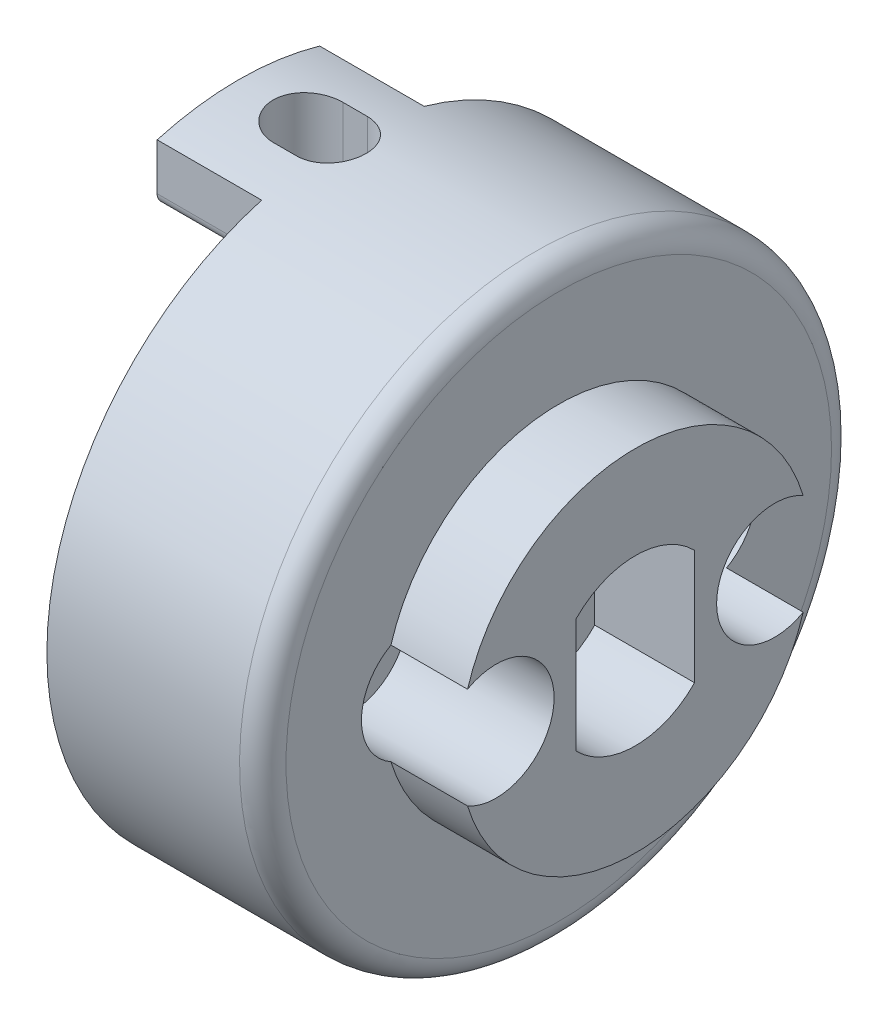
from build123d import *
from build123d.topology import SkipClean

# Parameters (mm, degrees)
SKETCH_1_R               = 12.75
EXTRUDE_1_DEPTH          = 7
EXTRUDE_START            = -2.3
SKETCH_1_3_R             = 12.75
SKETCH_1_3_R_2           = 9.75
EXTRUDE_2_DEPTH          = 2.3
EXTRUDE_3_DEPTH          = 3.3
FILLET_1_R               = 1
EXTRUDE_4_DEPTH          = 3.3
CUT_EXTRUDE_1_REACH      = 22.288
SKETCH_6_R               = 1.3500000000000005
SKETCH_6_R_2             = 1.5499999999999994
CUT_EXTRUDE_START        = -1
CUT_EXTRUDE_2_DEPTH      = 1
EXTRUDE_START_2          = 4.5
EXTRUDE_5_DEPTH          = 4.5
CUT_EXTRUDE_3_DEPTH      = 3
CUT_EXTRUDE_3_DEPTH_BACK = 25
SKETCH_17_R              = 2.5
SKETCH_17_R_2            = 2.5000000000000004
CUT_EXTRUDE_4_DEPTH      = 6.3
SKETCH_18_R              = 2.1
CUT_EXTRUDE_5_DEPTH      = 19.000000000000004


with BuildPart() as part:
    # 草图1 → 凸台-拉伸1 (new body)
    with BuildSketch(Plane(origin=(0, 0, 0), x_dir=(0, 0, -1), z_dir=(1, 0, 0))):
        Circle(SKETCH_1_R)
    extrude(amount=EXTRUDE_1_DEPTH)

    # 草图1<3> → 凸台-拉伸2 (add)
    with BuildSketch(Plane(origin=(0, 0, 0), x_dir=(0, 0, -1), z_dir=(1, 0, 0)).offset(EXTRUDE_START)):
        Circle(SKETCH_1_3_R)
        Circle(SKETCH_1_3_R_2, mode=Mode.SUBTRACT)
    extrude(amount=EXTRUDE_2_DEPTH)

    # 草图4 → 凸台-拉伸3 (add)
    with BuildSketch(Plane(origin=(7, 0, 0), x_dir=(0, 0, -1), z_dir=(1, 0, 0))):
        with BuildLine():
            Line((7.293731545630563, -1.9503794862215074), (5.5903528728314456, -1.4948876985254207))
            ThreePointArc((5.590352872831452, -1.4948876985253963), (4.450095710648993, -0.01722480337626947), (5.557231396787749, 1.4854144081735148))
            ThreePointArc((5.557231396787749, 1.4854144081735148), (5.599745988830406, 1.4974300406171406), (5.642585759719926, 1.508229114174971))
            Line((5.642585759719926, 1.5082291141749726), (7.293933423650666, 1.949624376989515))
            ThreePointArc((7.293933423650662, 1.949624376989514), (4.6e-16, 7.550000000000002), (-7.293933423650662, 1.949624376989515))
            Line((-7.293933423650666, 1.949624376989515), (-5.642585759719924, 1.5082291141749722))
            ThreePointArc((-5.642585759719924, 1.5082291141749706), (-5.599745988830406, 1.4974300406171406), (-5.557231396787749, 1.4854144081735148))
            ThreePointArc((-5.557231396787749, 1.4854144081735148), (-4.757262832498563, 0.9263392102844973), (-4.449999999999999, 0))
            ThreePointArc((-4.449999999999999, -3.8e-16), (-4.767633770522892, -0.9400922701758461), (-5.590352872831452, -1.4948876985253963))
            Line((-5.5903528728314456, -1.4948876985254207), (-7.293731545630563, -1.9503794862215074))
            ThreePointArc((-7.2937315456305605, -1.950379486221506), (-1.39e-15, -7.550000000000002), (7.2937315456305605, -1.9503794862215056))
        make_face()
        with BuildLine():
            ThreePointArc((-0.9205316546017519, -3.4285742624123157), (-1.7750000000000141, -3.074390183434749), (-2.5089665827097076, -2.5114909290789753))
            ThreePointArc((-2.5089665827097076, -2.5114909290789753), (-2.5295691102475106, -2.490738869589025), (-2.55, -2.4698178070456938))
            Line((-2.55, -2.4698178070456938), (-2.55, 0))
            Line((-2.55, 0), (-2.55, 2.4698178070456938))
            ThreePointArc((-2.55, 2.469817807045694), (2.2e-16, 3.5499999999999994), (2.55, 2.4698178070456938))
            Line((2.55, 2.4698178070456938), (2.55, -1.2e-16))
            Line((2.55, -1.2e-16), (2.55, -2.4698178070456938))
            ThreePointArc((2.549999999999999, -2.4698178070456946), (0.9453016753082151, -3.4218276903811913), (-0.9205316546017519, -3.4285742624123157))
        make_face(mode=Mode.SUBTRACT)
    extrude(amount=EXTRUDE_3_DEPTH)

    # 圆角1
    fillet_1_edges = [part.edges().sort_by_distance(p)[0] for p in [
        (7, 1.56e-15, 12.75),
    ]]
    fillet(fillet_1_edges, radius=FILLET_1_R)

    # 草图5 → 凸台-拉伸4 (add)
    with BuildSketch(Plane(origin=(7, 0, 0), x_dir=(0, 0, -1), z_dir=(1, 0, 0))):
        with BuildLine():
            ThreePointArc((5.65345654698472, -1.3047634403110198), (4.6499999999999995, 1.7e-16), (5.65345654698472, 1.3047634403110198))
            Line((5.65345654698472, 1.3047634403110195), (7.3500000000000005, 1.7553631492193538))
            Line((7.3500000000000005, 1.7553631492193538), (7.293933423650666, 1.9496243769895145))
            Line((7.293933423650666, 1.9496243769895145), (5.642585759719882, 1.5082291141749606))
            ThreePointArc((5.642585759719882, 1.5082291141749606), (4.4500975021885605, 0.01738526036219645), (5.60884432582712, -1.499832403491257))
            Line((5.60884432582712, -1.499832403491257), (7.293731545630563, -1.950379486221502))
            Line((7.293731545630563, -1.950379486221502), (7.3500000000000005, -1.7595376594411802))
            Line((7.3500000000000005, -1.7595376594411802), (5.65345654698472, -1.3047634403110195))
        make_face()
    extrude(amount=EXTRUDE_4_DEPTH)

    # 草图6 → 切除-拉伸1 (cut, up to next)
    with BuildSketch(Plane(origin=(7, 0, 0), x_dir=(0, 0, -1), z_dir=(1, 0, 0)), mode=Mode.PRIVATE) as cut_extrude_1_sk1:
        with Locations(Location((6, 0, 0), (0, 0, 255.125726416))):
            Circle(SKETCH_6_R)
    cut_extrude_1_tool1 = extrude(cut_extrude_1_sk1.sketch, amount=-CUT_EXTRUDE_1_REACH, mode=Mode.PRIVATE) & part.part
    # 草图6 → 切除-拉伸1 (cut, up to next)
    with BuildSketch(Plane(origin=(7, 0, 0), x_dir=(0, 0, -1), z_dir=(1, 0, 0)), mode=Mode.PRIVATE) as cut_extrude_1_sk2:
        with Locations(Location((-6, -7.3e-16, 0), (0, 0, 76.668199875))):
            Circle(SKETCH_6_R_2)
    cut_extrude_1_tool2 = extrude(cut_extrude_1_sk2.sketch, amount=-CUT_EXTRUDE_1_REACH, mode=Mode.PRIVATE) & part.part
    add(cut_extrude_1_tool1.solids().sort_by_distance((7, 0, -6))[0], mode=Mode.SUBTRACT)
    add(cut_extrude_1_tool2.solids().sort_by_distance((7, 0, 6))[0], mode=Mode.SUBTRACT)

    # 草图7 → 切除-拉伸2 (cut)
    with BuildSketch(Plane(origin=(7, 0, 0), x_dir=(0, 0, -1), z_dir=(1, 0, 0)).offset(CUT_EXTRUDE_START)):
        with BuildLine():
            Line((2.55, -2.4698178070456938), (2.55, 2.4698178070456938))
            ThreePointArc((2.55, 2.4698178070456938), (2.2e-16, 3.55), (-2.55, 2.4698178070456938))
            Line((-2.55, 2.4698178070456938), (-2.55, -2.4698178070456938))
            ThreePointArc((-2.55, -2.4698178070456938), (2.2e-16, -3.55), (2.55, -2.4698178070456938))
        make_face()
    extrude(amount=CUT_EXTRUDE_2_DEPTH, mode=Mode.SUBTRACT)

    # 草图9 → 凸台-拉伸5 (add)
    with SkipClean():  # the faces are left unmerged after this step: merging them gives an invalid solid
        with BuildSketch(Plane.ZY.offset(2.3).offset(EXTRUDE_START_2)):
            with BuildLine():
                ThreePointArc((-3.4999999999999996, 10.25), (-3.3535533905932735, 9.896446609406727), (-3, 9.75))
                Line((-3, 9.75), (3, 9.75))
                ThreePointArc((3, 9.75), (3.3535533905932735, 9.896446609406727), (3.5000000000000004, 10.25))
                Line((3.5, 10.25), (3.5, 12.260199835239227))
                ThreePointArc((3.5000000000000004, 12.260199835239227), (1e-15, 12.75), (-3.5, 12.260199835239227))
                Line((-3.5, 12.260199835239227), (-3.5, 10.25))
            make_face()
            with BuildLine():
                Line((-3.5, -10.25), (-3.5, -12.260199835239227))
                ThreePointArc((-3.5, -12.260199835239227), (1e-15, -12.75), (3.5000000000000004, -12.260199835239227))
                Line((3.5, -12.260199835239227), (3.5, -10.25))
                ThreePointArc((3.5000000000000004, -10.25), (3.3535533905932735, -9.896446609406727), (3, -9.75))
                Line((3, -9.75), (-3, -9.75))
                ThreePointArc((-3, -9.75), (-3.3535533905932735, -9.896446609406727), (-3.4999999999999996, -10.25))
            make_face()
        extrude(amount=-EXTRUDE_5_DEPTH)

    # 草图16 → 切除-拉伸3 (cut, two sides: drawn at the far end of the back side and taken through both)
    with BuildSketch(Plane(origin=(0, 9.75, 0), x_dir=(1, 0, 0), z_dir=(0, 1, 0)).offset(-CUT_EXTRUDE_3_DEPTH_BACK)):
        with BuildLine():
            Line((-3.797155055625174, 1.499995743144704), (-3.8000000000000003, 1.499998441052766))
            ThreePointArc((-3.8000000000000003, 1.499998441052766), (-5.299998441052766, 3.3e-16), (-3.8000000000000007, -1.4999984410527665))
            Line((-3.8000000000000003, -1.4999984410527663), (-3.7988775259417356, -1.4999980210696007))
            Line((-3.7988775259417356, -1.4999980210696007), (-2.8462661595831507, -1.4996415934672602))
            ThreePointArc((-2.8462661595831507, -1.4996415934672602), (-1.300658265078132, -0.05513463794275678), (-2.735998812247351, 1.4989894310320704))
            Line((-2.735998812247351, 1.49898943103207), (-2.8611580419850906, 1.4991081216110296))
            Line((-2.8611580419850906, 1.4991081216110296), (-3.797155055625174, 1.499995743144704))
        make_face()
    extrude(amount=CUT_EXTRUDE_3_DEPTH + CUT_EXTRUDE_3_DEPTH_BACK, mode=Mode.SUBTRACT)

    # 草图17 → 切除-拉伸4 (cut)
    with SkipClean():  # the faces are left unmerged after this step: merging them gives an invalid solid
        with BuildSketch(Plane(origin=(10.3, 0, 0), x_dir=(0, 0, -1), z_dir=(1, 0, 0))):
            with Locations((-6, 0)):
                Circle(SKETCH_17_R)
            with Locations((6, 0)):
                Circle(SKETCH_17_R_2)
        extrude(amount=-CUT_EXTRUDE_4_DEPTH, mode=Mode.SUBTRACT)

    # 草图18 → 切除-拉伸5 (cut)
    with SkipClean():  # the faces are left unmerged after this step: merging them gives an invalid solid
        with BuildSketch(Plane(origin=(10.3, 0, 0), x_dir=(0, 0, -1), z_dir=(1, 0, 0))):
            Circle(SKETCH_18_R)
        extrude(amount=-CUT_EXTRUDE_5_DEPTH, mode=Mode.SUBTRACT)


solid = part.part
